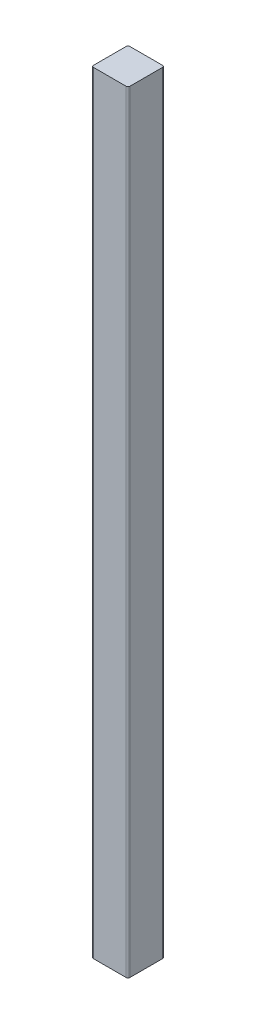
from build123d import *

# Parameters (mm, degrees)
BOSS_EXTRUDE1_DEPTH = 850


with BuildPart() as part:
    # Sketch1 → Boss-Extrude1 (new body)
    with BuildSketch(Plane(origin=(0, 0, 0), x_dir=(1, 0, 0), z_dir=(0, 1, 0))):
        with BuildLine():
            Line((-18, 20), (18, 20))
            ThreePointArc((18, 20), (19.414213562, 19.414213562), (20, 18))
            Line((20, 18), (20, -18))
            ThreePointArc((20, -18), (19.414213562, -19.414213562), (18, -20))
            Line((18, -20), (-18, -20))
            ThreePointArc((-18, -20), (-19.414213562, -19.414213562), (-20, -18))
            Line((-20, -18), (-20, 18))
            ThreePointArc((-20, 18), (-19.414213562, 19.414213562), (-18, 20))
        make_face()
    extrude(amount=BOSS_EXTRUDE1_DEPTH)


solid = part.part
